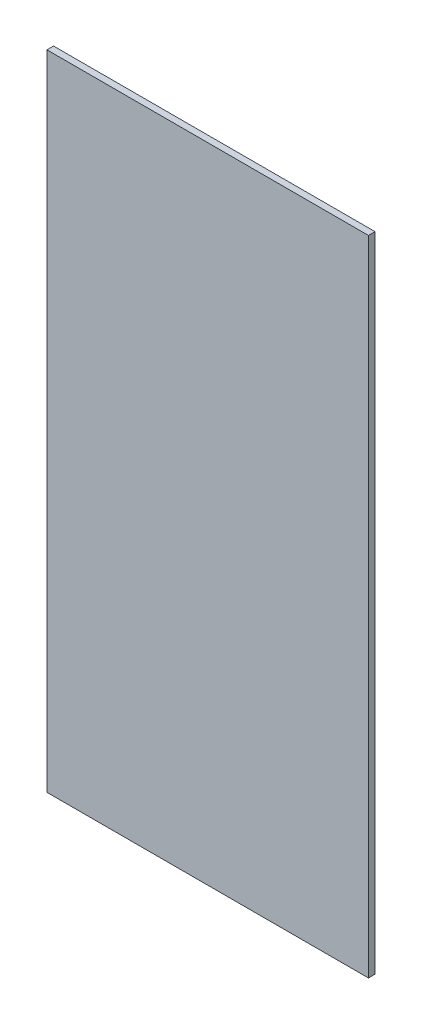
from build123d import *

# Parameters (mm, degrees)
SKETCH1_W           = 609.6
SKETCH1_H           = 1219.2
BOSS_EXTRUDE1_DEPTH = 12.5


with BuildPart() as part:
    # Sketch1 → Boss-Extrude1 (new body)
    with BuildSketch(Plane.XY):
        Rectangle(SKETCH1_W, SKETCH1_H)
    extrude(amount=BOSS_EXTRUDE1_DEPTH)


solid = part.part
